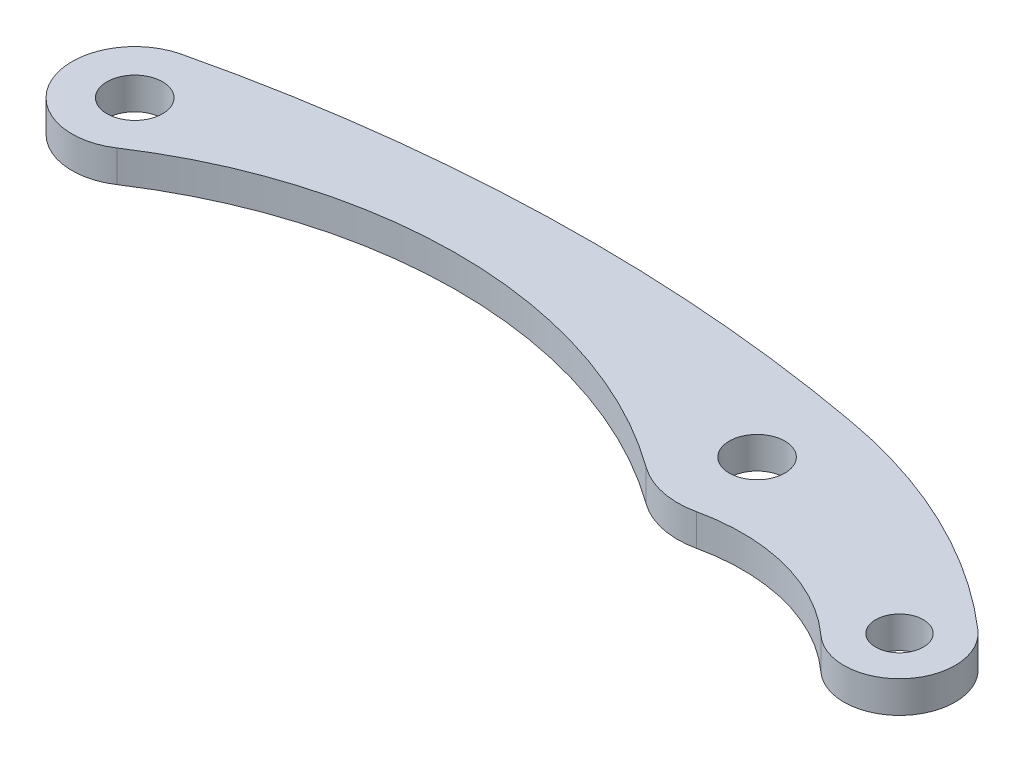
from build123d import *

# Parameters (mm, degrees)
SKETCH1_R           = 1.75
SKETCH1_R_2         = 3.5
BOSS_EXTRUDE3_DEPTH = 2
SKETCH3_R           = 1.5
CUT_EXTRUDE1_DEPTH  = 58.460820006


with BuildPart() as part:
    # Sketch1 → Boss-Extrude3 (new body)
    # profile 1 of 2: a face of its own
    with BuildSketch(Plane(origin=(0, 0, 0), x_dir=(1, 0, 0), z_dir=(0, 1, 0))):
        with BuildLine():
            ThreePointArc((40.05780493, 4.92208645), (19.51761867, 6.504088301), (-0.91087774, 3.843540262))
            ThreePointArc((-0.91087774, 3.843540262), (-3.626704772, -1.56509185), (2.171657179, -3.299455273))
            ThreePointArc((2.171657179, -3.299455273), (19.326940327, 1.634092765), (36.247955143, -4.051229892))
            ThreePointArc((36.247955143, -4.051229892), (38.163769521, -4.895969245), (40.257507506, -4.882165276))
            ThreePointArc((40.257507506, -4.882165276), (45.933967375, -5.003120525), (50.919436714, -7.720089844))
            ThreePointArc((50.919436714, -7.720089844), (50.66068815, -2.80185284), (55.57610439, -2.494136696))
            ThreePointArc((55.57610439, -2.494136696), (48.324550131, 2.276108307), (40.05780493, 4.92208645))
        make_face()
        with Locations(Location((0, 0, 0), (0, 0, 270))):
            Circle(SKETCH1_R, mode=Mode.SUBTRACT)
        with Locations(Location((39.178405, 0, 0), (0, 0, 270))):
            Circle(SKETCH1_R, mode=Mode.SUBTRACT)
    # profile 2 of 2: a face of its own
    with BuildSketch(Plane(origin=(0, 0, 0), x_dir=(1, 0, 0), z_dir=(0, 1, 0))):
        with Locations((53.273794312, -5.13030215)):
            Circle(SKETCH1_R_2)
    extrude(amount=BOSS_EXTRUDE3_DEPTH)

    # Sketch3 → Cut-Extrude1 (cut, through all)
    with BuildSketch(Plane(origin=(0, 2, 0), x_dir=(1, 0, 0), z_dir=(0, 1, 0))):
        with Locations(Location((53.273794312, -5.13030215, 0), (0, 0, 270))):
            Circle(SKETCH3_R)
    extrude(amount=-CUT_EXTRUDE1_DEPTH, mode=Mode.SUBTRACT)


solid = part.part
